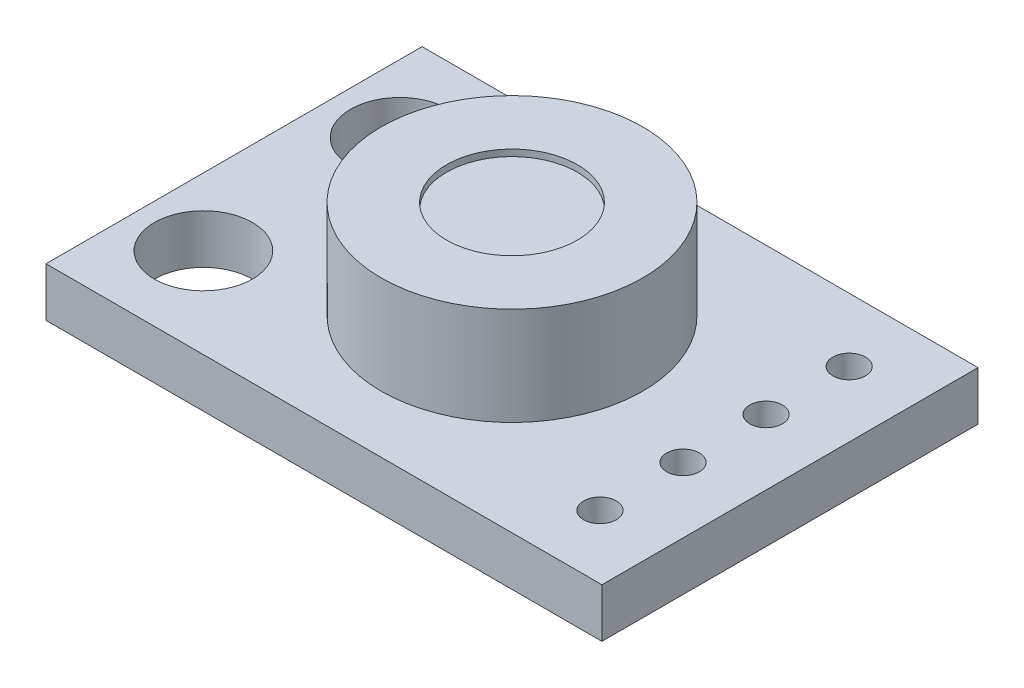
from build123d import *

# Parameters (mm, degrees)
SKETCH_1_W          = 17
SKETCH_1_H          = 11.5
EXTRUDE_1_DEPTH     = 1.5
SKETCH_2_R          = 4
EXTRUDE_2_DEPTH     = 3
SKETCH_3_R          = 2
CUT_EXTRUDE_1_DEPTH = 0.2
SKETCH_4_R          = 0.5
SKETCH_4_R_2        = 1.5
CUT_EXTRUDE_2_DEPTH = 11.69170239


with BuildPart() as part:
    # Эскиз1 → Бобышка-Вытянуть1 (new body)
    with BuildSketch(Plane(origin=(0, 0, 0), x_dir=(1, 0, 0), z_dir=(0, 1, 0))):
        Rectangle(SKETCH_1_W, SKETCH_1_H)
    extrude(amount=EXTRUDE_1_DEPTH)

    # Эскиз2 → Бобышка-Вытянуть2 (add)
    with BuildSketch(Plane(origin=(0, 1.5, 0), x_dir=(1, 0, 0), z_dir=(0, 1, 0))):
        with Locations(Location((0, 0, 0), (0, 0, 270))):
            Circle(SKETCH_2_R)
    extrude(amount=EXTRUDE_2_DEPTH)

    # Эскиз3 → Вырез-Вытянуть1 (cut)
    with BuildSketch(Plane(origin=(0, 4.5, 0), x_dir=(1, 0, 0), z_dir=(0, 1, 0))):
        with Locations(Location((0, 0, 0), (0, 0, 270))):
            Circle(SKETCH_3_R)
    extrude(amount=-CUT_EXTRUDE_1_DEPTH, mode=Mode.SUBTRACT)

    # Эскиз4 → Вырез-Вытянуть2 (cut, through all)
    with BuildSketch(Plane(origin=(0, 1.5, 0), x_dir=(1, 0, 0), z_dir=(0, 1, 0))):
        with Locations(Location((6.5, 3.81, 0), (0, 0, 270))):
            Circle(SKETCH_4_R)
        with Locations(Location((6.5, 1.27, 0), (0, 0, 270))):
            Circle(SKETCH_4_R)
        with Locations(Location((6.5, -1.27, 0), (0, 0, 270))):
            Circle(SKETCH_4_R)
        with Locations(Location((6.5, -3.81, 0), (0, 0, 270))):
            Circle(SKETCH_4_R)
        with Locations(Location((-6.43732089, 3, 0), (0, 0, 270))):
            Circle(SKETCH_4_R_2)
        with Locations(Location((-6.43732089, -3, 0), (0, 0, 270))):
            Circle(SKETCH_4_R_2)
    extrude(amount=-CUT_EXTRUDE_2_DEPTH, mode=Mode.SUBTRACT)


solid = part.part
